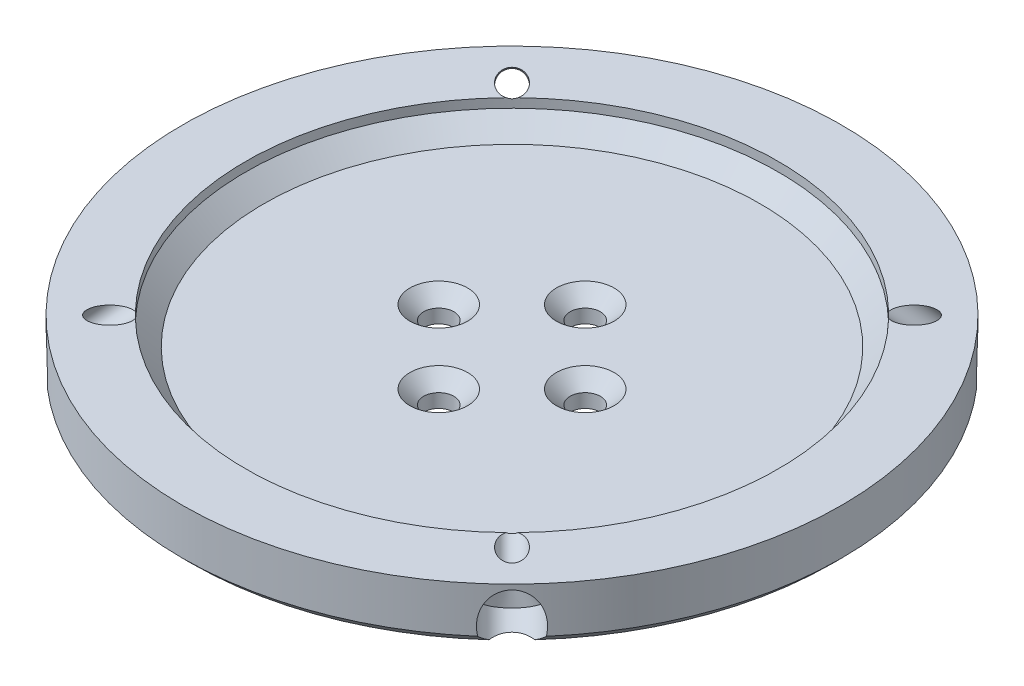
from build123d import *
from build123d.topology import SkipClean

# Parameters (mm, degrees)
SKETCH1_R                                         = 35.99999999999999
BOSS_EXTRUDE1_DEPTH                               = 1.5
CSK_FOR_M3_FLAT_HEAD_MACHINE_SCREW1_AT_2_COUNT    = 2
CSK_FOR_M3_FLAT_HEAD_MACHINE_SCREW1_AT_2_PITCH    = 11.313708498984761
CSK_FOR_M3_FLAT_HEAD_MACHINE_SCREW1_AT_3_COUNT    = 2
CSK_FOR_M3_FLAT_HEAD_MACHINE_SCREW1_AT_3_PITCH    = 16
CSK_FOR_M3_FLAT_HEAD_MACHINE_SCREW1_AT_4_COUNT    = 2
CSK_FOR_M3_FLAT_HEAD_MACHINE_SCREW1_AT_4_PITCH    = 11.31370849898476
BOSS_EXTRUDE2_START                               = 3
SKETCH5_R                                         = 35.99999999999999
SKETCH5_R_2                                       = 29.100000000000005
BOSS_EXTRUDE2_DEPTH                               = 3
CHAMFER1_SIZE                                     = 1
SKETCH6_R                                         = 1.1
CUT_EXTRUDE1_DEPTH                                = 79.25232244736567
CUT_EXTRUDE3_START                                = -4
SKETCH7_R                                         = 2.749999999999998
CUT_EXTRUDE3_DEPTH                                = 9.5
BOSS_EXTRUDE3_START                               = 0.238218
SKETCH11_R                                        = 2.749999999999992
SKETCH11_R_2                                      = 1.0999999999999934
BOSS_EXTRUDE3_DEPTH                               = 0.238218
CSK_FOR_M2_5_FLAT_HEAD_MACHINE_SCREW2_D           = 2.7
CSK_FOR_M2_5_FLAT_HEAD_MACHINE_SCREW2_CSINK_D     = 5.5
CSK_FOR_M2_5_FLAT_HEAD_MACHINE_SCREW2_CSINK_ANGLE = 90
CIRPATTERN1_COUNT                                 = 4
CHAMFER2_SIZE                                     = 2


with BuildPart() as part:
    # Sketch1 → Boss-Extrude1 (new, symmetric)
    with BuildSketch(Plane(origin=(0, 0, 0), x_dir=(1, 0, 0), z_dir=(0, 1, 0))):
        with Locations(Location((0, 0, 0), (0, 0, 270))):
            Circle(SKETCH1_R)
    extrude(amount=BOSS_EXTRUDE1_DEPTH, both=True)

    # Sketch4 → CSK for M3 Flat Head Machine Screw1 (revolve, cut)
    with BuildSketch(Plane(origin=(0, 1.5, -8), x_dir=(0, 0, 1), z_dir=(1, 0, 0))):
        Polygon((0, 0), (-7.3e-16, 3.0000000000000027), (1.6499999999999873, 3.0000000000000027), (1.6499999999999992, 1.4999999999999998), (3.15, -1.73e-15), align=None)
    csk_for_m3_flat_head_machine_screw1 = revolve(axis=Axis((0, 7.849999999999991, -8), (0, -1, 0)), mode=Mode.SUBTRACT)

    # CSK for M3 Flat Head Machine Screw1 at 2: CSK for M3 Flat Head Machine Screw1 ×2
    with Locations(*[Vector(-0.7071067811865475, 0, 0.7071067811865477) * (i * CSK_FOR_M3_FLAT_HEAD_MACHINE_SCREW1_AT_2_PITCH) for i in range(1, CSK_FOR_M3_FLAT_HEAD_MACHINE_SCREW1_AT_2_COUNT)]):
        add(csk_for_m3_flat_head_machine_screw1, mode=Mode.SUBTRACT)

    # CSK for M3 Flat Head Machine Screw1 at 3: CSK for M3 Flat Head Machine Screw1 ×2
    with Locations(*[(0, 0, i * CSK_FOR_M3_FLAT_HEAD_MACHINE_SCREW1_AT_3_PITCH) for i in range(1, CSK_FOR_M3_FLAT_HEAD_MACHINE_SCREW1_AT_3_COUNT)]):
        add(csk_for_m3_flat_head_machine_screw1, mode=Mode.SUBTRACT)

    # CSK for M3 Flat Head Machine Screw1 at 4: CSK for M3 Flat Head Machine Screw1 ×2
    with Locations(*[Vector(0.7071067811865476, 0, 0.7071067811865475) * (i * CSK_FOR_M3_FLAT_HEAD_MACHINE_SCREW1_AT_4_PITCH) for i in range(1, CSK_FOR_M3_FLAT_HEAD_MACHINE_SCREW1_AT_4_COUNT)]):
        add(csk_for_m3_flat_head_machine_screw1, mode=Mode.SUBTRACT)

    # Sketch5 → Boss-Extrude2 (add)
    with BuildSketch(Plane(origin=(0, 1.5, 0), x_dir=(1, 0, 0), z_dir=(0, 1, 0)).offset(BOSS_EXTRUDE2_START)):
        with Locations(Location((0, 0, 0), (0, 0, 270))):
            Circle(SKETCH5_R)
        with Locations(Location((0, 0, 0), (0, 0, 270))):
            Circle(SKETCH5_R_2, mode=Mode.SUBTRACT)
    extrude(amount=-BOSS_EXTRUDE2_DEPTH)

    # Chamfer1
    chamfer1_edges = [part.edges().sort_by_distance(p)[0] for p in [
        (1.102e-14, -1.5, -35.99999999999999),
    ]]
    chamfer(chamfer1_edges, length=CHAMFER1_SIZE)

    # Sketch6 → Cut-Extrude1 (cut, through all)
    with BuildSketch(Plane(origin=(16.82940447199797, -18.77088340984431, -16.829404471998032), x_dir=(-0.7071067811865487, 0, -0.7071067811865464), z_dir=(-0.5416752204197003, 0.6427876096865406, 0.5416752204197022))):
        with Locations(Location((8.7e-16, -22.5, 0), (0, 0, 322.559260544))):
            Circle(SKETCH6_R)
    cut_extrude1 = extrude(amount=CUT_EXTRUDE1_DEPTH, mode=Mode.SUBTRACT)

    # Sketch7 → Cut-Extrude3 (cut)
    with BuildSketch(Plane(origin=(16.82940447199797, -18.77088340984431, -16.829404471998032), x_dir=(-0.7071067811865487, 0, -0.7071067811865464), z_dir=(-0.5416752204197003, 0.6427876096865406, 0.5416752204197022)).offset(CUT_EXTRUDE3_START)):
        with Locations(Location((-8.7e-16, -22.499999999999996, 0), (0, 0, 122.73240721))):
            Circle(SKETCH7_R)
    cut_extrude3 = extrude(amount=CUT_EXTRUDE3_DEPTH, mode=Mode.SUBTRACT)

    # Sketch11 → Boss-Extrude3 (add)
    with SkipClean():  # the faces are left unmerged after this step: merging them gives an invalid solid
        with BuildSketch(Plane(origin=(13.432372215497617, -15.939740463168505, -13.432372215497661), x_dir=(0.840587863095387, 0.41421264265922275, 0.3490557707272493), z_dir=(0.5416752204197004, -0.6427876096865405, -0.5416752204197021)).offset(BOSS_EXTRUDE3_START)):
            with Locations((12.663169740062129, -19.700394888192456)):
                Circle(SKETCH11_R)
            with Locations(Location((12.663169740062129, -19.700394888192452, 0), (0, 0, 270))):
                Circle(SKETCH11_R_2, mode=Mode.SUBTRACT)
        boss_extrude3 = extrude(amount=-BOSS_EXTRUDE3_DEPTH)

    # CSK for M2.5 Flat Head Machine Screw2 (through all)
    with Locations(Plane(origin=(13.561408767304565, -16.092863762096435, -13.561408767304608), x_dir=(-0.840587863095387, -0.4142126426592227, -0.34905577072724936), z_dir=(0.5416752204197004, -0.6427876096865405, -0.5416752204197022))):
        with Locations((-12.66316974, 19.700394888)):
            csk_for_m2_5_flat_head_machine_screw2 = CounterSinkHole(CSK_FOR_M2_5_FLAT_HEAD_MACHINE_SCREW2_D / 2, CSK_FOR_M2_5_FLAT_HEAD_MACHINE_SCREW2_CSINK_D / 2, counter_sink_angle=CSK_FOR_M2_5_FLAT_HEAD_MACHINE_SCREW2_CSINK_ANGLE)

    # CirPattern1: Cut-Extrude1, Cut-Extrude3, Boss-Extrude3, CSK for M2.5 Flat Head Machine Screw2 ×4 about axis
    with SkipClean():  # the faces are left unmerged after this step: merging them gives an invalid solid
        cirpattern1_axis = Axis((0, -2.6041150623403984, 0), (0, 1, 0))
        add([cut_extrude1.rotate(cirpattern1_axis, i * 360 / CIRPATTERN1_COUNT) for i in range(1, CIRPATTERN1_COUNT)], mode=Mode.SUBTRACT)
        add([cut_extrude3.rotate(cirpattern1_axis, i * 360 / CIRPATTERN1_COUNT) for i in range(1, CIRPATTERN1_COUNT)], mode=Mode.SUBTRACT)
        add([boss_extrude3.rotate(cirpattern1_axis, i * 360 / CIRPATTERN1_COUNT) for i in range(1, CIRPATTERN1_COUNT)])
        add([csk_for_m2_5_flat_head_machine_screw2.rotate(cirpattern1_axis, i * 360 / CIRPATTERN1_COUNT) for i in range(1, CIRPATTERN1_COUNT)], mode=Mode.SUBTRACT)

    # Chamfer2
    chamfer2_edges = [part.edges().sort_by_distance(p)[0] for p in [
        (8.91e-15, 1.5, -29.100000000000005),
    ]]
    chamfer(chamfer2_edges, length=CHAMFER2_SIZE)


solid = part.part
